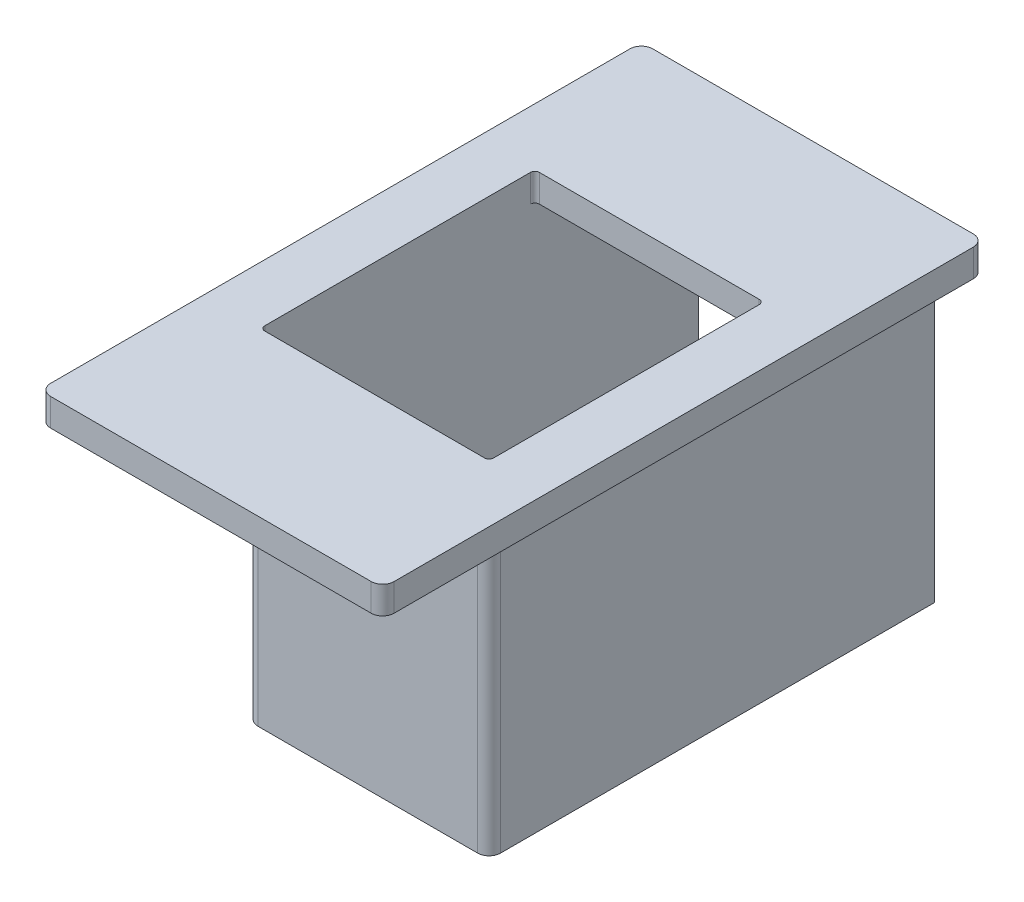
from build123d import *

# Parameters (mm, degrees)
CROQUIS1_W              = 1000
CROQUIS1_H              = 1200
SALIENTE_EXTRUIR1_DEPTH = 120
REDONDEO1_R             = 20
SALIENTE_EXTRUIR2_DEPTH = 1480
CROQUIS3_W              = 30
CROQUIS3_H              = 735
SALIENTE_EXTRUIR3_DEPTH = 1360
CORTAR_EXTRUIR1_DEPTH   = 1360


with BuildPart() as part:
    # Croquis1 → Saliente-Extruir1 (new body)
    with BuildSketch(Plane(origin=(0, 0, 0), x_dir=(1, 0, 0), z_dir=(0, 1, 0))):
        with BuildLine():
            Line((-700, 1315), (700, 1315))
            ThreePointArc((700, 1315), (735.355339059, 1300.355339059), (750, 1265))
            Line((750, 1265), (750, -1265))
            ThreePointArc((750, -1265), (735.355339059, -1300.355339059), (700, -1315))
            Line((700, -1315), (-700, -1315))
            ThreePointArc((-700, -1315), (-735.355339059, -1300.355339059), (-750, -1265))
            Line((-750, -1265), (-750, 1265))
            ThreePointArc((-750, 1265), (-735.355339059, 1300.355339059), (-700, 1315))
        make_face()
        Rectangle(CROQUIS1_W, CROQUIS1_H, mode=Mode.SUBTRACT)
    extrude(amount=SALIENTE_EXTRUIR1_DEPTH)

    # Redondeo1
    redondeo1_edges = [part.edges().sort_by_distance(p)[0] for p in [
        (500, 60, 600),
        (500, 60, -600),
        (-500, 60, -600),
        (-500, 60, 600),
    ]]
    fillet(redondeo1_edges, radius=REDONDEO1_R)

    # Croquis2 → Saliente-Extruir2 (add)
    with BuildSketch(Plane(origin=(0, 120, 0), x_dir=(1, 0, 0), z_dir=(0, 1, 0))):
        with BuildLine():
            Line((-530, -580), (-530, 580))
            ThreePointArc((-530, 580), (-515.355339059, 615.355339059), (-480, 630))
            Line((-480, 630), (480, 630))
            ThreePointArc((480, 630), (515.355339059, 615.355339059), (530, 580))
            Line((530, 580), (530, -580))
            ThreePointArc((530, -580), (515.355339059, -615.355339059), (480, -630))
            Line((480, -630), (-480, -630))
            ThreePointArc((-480, -630), (-515.355339059, -615.355339059), (-530, -580))
        make_face()
        with BuildLine():
            Line((-500, -580), (-500, 580))
            ThreePointArc((-500, 580), (-494.142135624, 594.142135624), (-480, 600))
            Line((-480, 600), (480, 600))
            ThreePointArc((480, 600), (494.142135624, 594.142135624), (500, 580))
            Line((500, 580), (500, -580))
            ThreePointArc((500, -580), (494.142135624, -594.142135624), (480, -600))
            Line((480, -600), (-480, -600))
            ThreePointArc((-480, -600), (-494.142135624, -594.142135624), (-500, -580))
        make_face(mode=Mode.SUBTRACT)
    extrude(amount=-SALIENTE_EXTRUIR2_DEPTH)

    # Croquis3 → Saliente-Extruir3 (add)
    with BuildSketch(Plane.XZ):
        with Locations((515, -947.5)):
            Rectangle(CROQUIS3_W, CROQUIS3_H)
        with Locations((-515, -947.5)):
            Rectangle(CROQUIS3_W, CROQUIS3_H)
    extrude(amount=SALIENTE_EXTRUIR3_DEPTH)

    # Croquis4 → Cortar-Extruir1 (cut)
    with BuildSketch(Plane.XZ.offset(1360)):
        Polygon((500, -580), (500, -639.785784225), (-500, -639.785784225), (-500, -563.731822734), (500, -563.731822734), align=None)
    extrude(amount=-CORTAR_EXTRUIR1_DEPTH, mode=Mode.SUBTRACT)


solid = part.part
